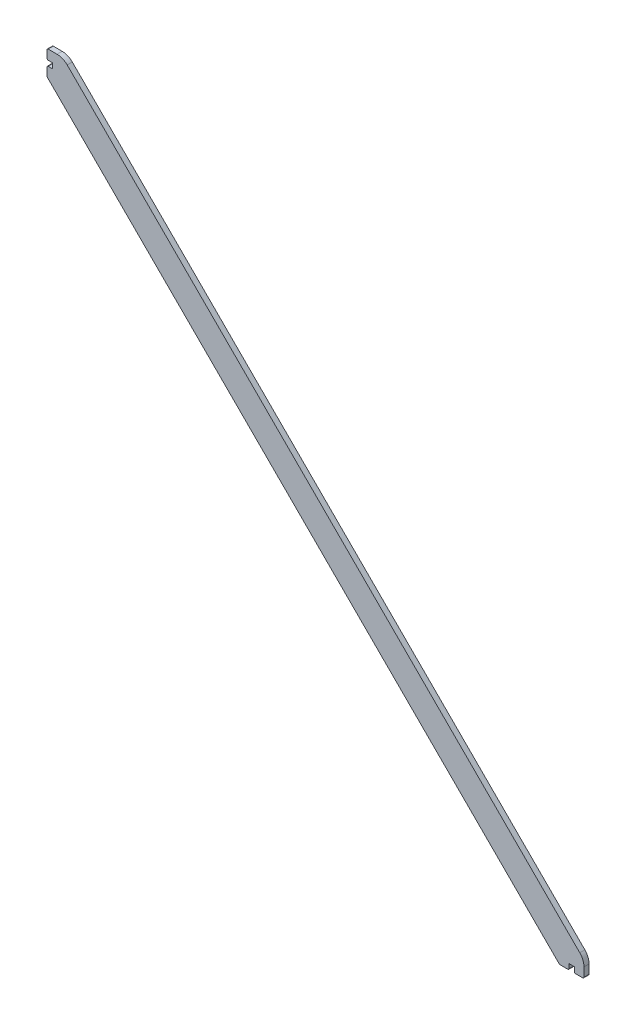
from build123d import *

# Parameters (mm, degrees)
BOSS_EXTRUDE1_DEPTH = 4


with BuildPart() as part:
    # Sketch1 → Boss-Extrude1 (new body)
    with BuildSketch(Plane.XY):
        with BuildLine():
            Line((-201.35, 212.6), (-208.304951288, 212.6))
            ThreePointArc((-208.304951288, 212.6), (-209.01205807, 212.307106781), (-209.304951288, 211.6))
            Line((-209.304951288, 211.6), (-209.304951288, 206))
            ThreePointArc((-209.304951288, 206), (-209.01205807, 205.292893219), (-208.304951288, 205))
            Line((-208.304951288, 205), (-205, 205))
            Line((-205, 205), (-205, 200.9))
            Line((-205, 200.9), (-208.304951288, 200.9))
            ThreePointArc((-208.304951288, 200.9), (-209.01205807, 200.607106781), (-209.304951288, 199.9))
            Line((-209.304951288, 199.9), (-209.304951288, 193.809262274))
            ThreePointArc((-209.304951288, 193.809262274), (-209.228830821, 193.426578842), (-209.01205807, 193.102155493))
            Line((-209.01205807, 193.102155493), (-205, 189.090097423))
            Line((-205, 189.090097423), (189.090097423, -205))
            Line((189.090097423, -205), (193.102155493, -209.01205807))
            ThreePointArc((193.102155493, -209.01205807), (193.426578842, -209.228830821), (193.809262274, -209.304951288))
            Line((193.809262274, -209.304951288), (199.9, -209.304951288))
            ThreePointArc((199.9, -209.304951288), (200.607106781, -209.01205807), (200.9, -208.304951288))
            Line((200.9, -208.304951288), (200.9, -205))
            Line((200.9, -205), (205, -205))
            Line((205, -205), (205, -208.304951288))
            ThreePointArc((205, -208.304951288), (205.292893219, -209.01205807), (206, -209.304951288))
            Line((206, -209.304951288), (211.6, -209.304951288))
            ThreePointArc((211.6, -209.304951288), (212.307106781, -209.01205807), (212.6, -208.304951288))
            Line((212.6, -208.304951288), (212.6, -201.35))
            ThreePointArc((212.6, -201.35), (211.743644741, -197.044811386), (209.304951288, -193.395048712))
            Line((209.304951288, -193.395048712), (205, -189.090097423))
            Line((205, -189.090097423), (-189.090097423, 205))
            Line((-189.090097423, 205), (-193.395048712, 209.304951288))
            ThreePointArc((-193.395048712, 209.304951288), (-197.044811386, 211.743644741), (-201.35, 212.6))
        make_face()
    extrude(amount=BOSS_EXTRUDE1_DEPTH)


solid = part.part
